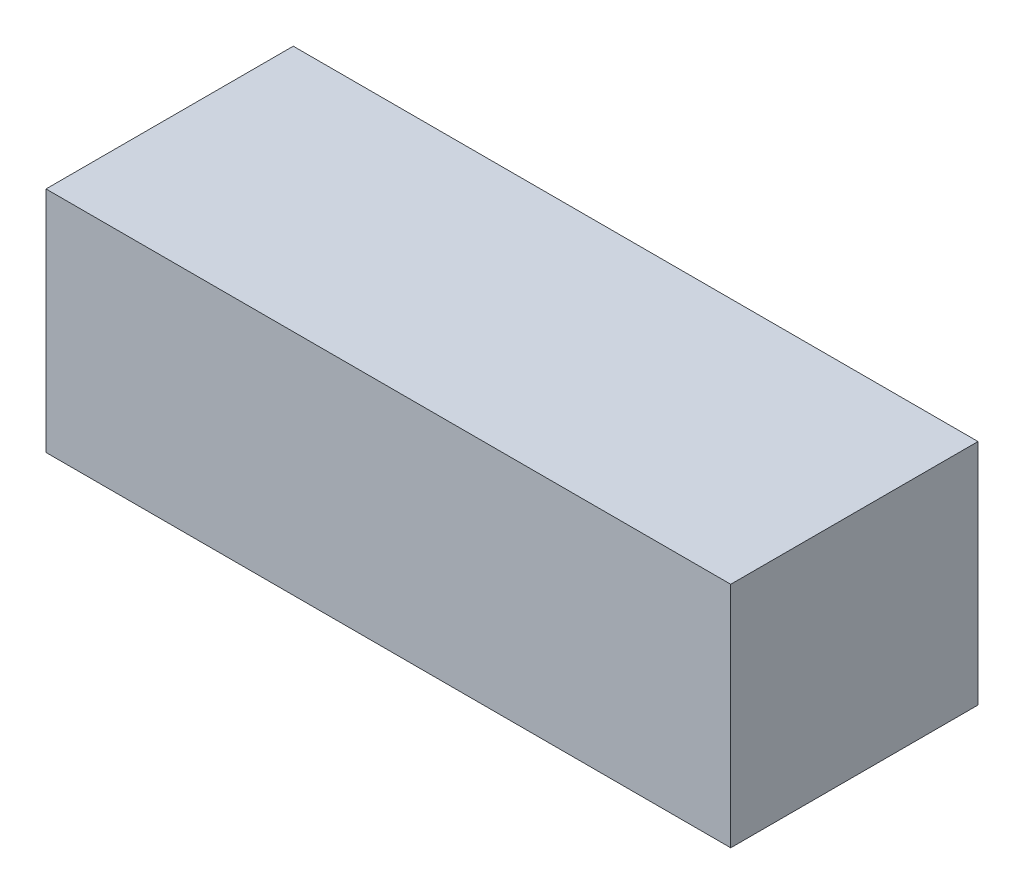
from build123d import *

# Parameters (mm, degrees)
SKETCH_1_W      = 180
SKETCH_1_H      = 65
EXTRUDE_1_DEPTH = 60


with BuildPart() as part:
    # Эскиз1 → Бобышка-Вытянуть1 (new body)
    with BuildSketch(Plane(origin=(0, 0, 0), x_dir=(1, 0, 0), z_dir=(0, 1, 0))):
        Rectangle(SKETCH_1_W, SKETCH_1_H)
    extrude(amount=EXTRUDE_1_DEPTH)


solid = part.part
